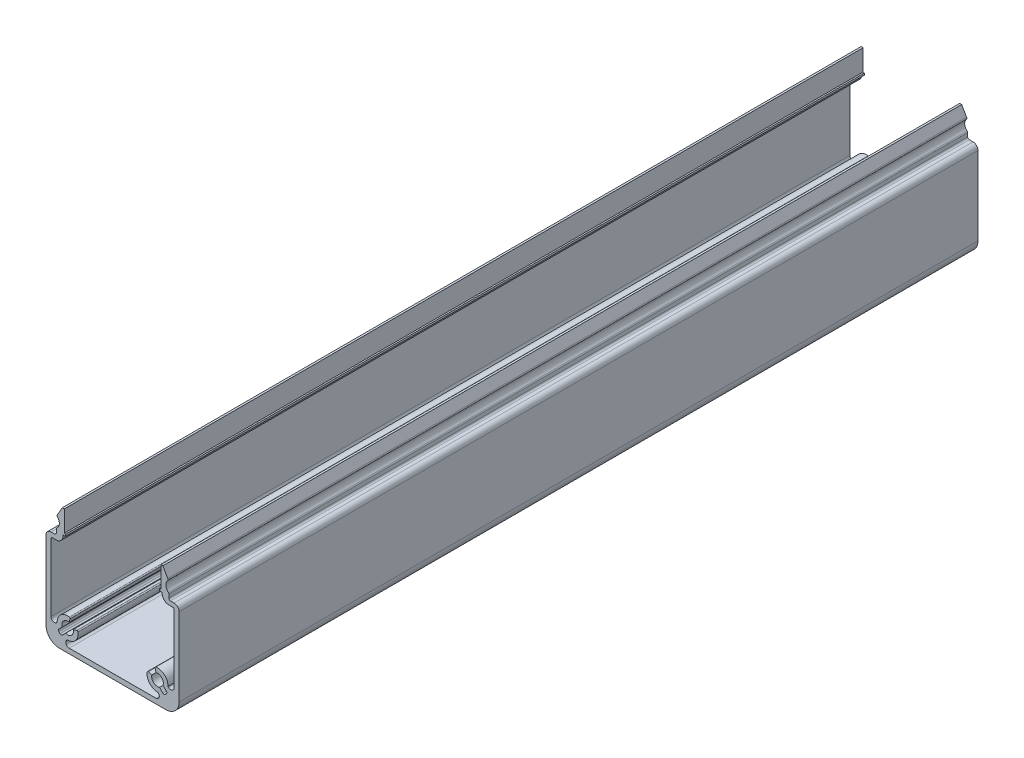
from build123d import *

# Parameters (mm, degrees)
BOSS_EXTRUDE1_DEPTH = 240


with BuildPart() as part:
    # Sketch1 → Boss-Extrude1 (new body)
    with BuildSketch(Plane.XY.offset(20)):
        with BuildLine():
            Line((4, 0), (36, 0))
            ThreePointArc((36, 0), (38.828427125, 1.171572875), (40, 4))
            Line((40, 4), (40, 27.499999994))
            ThreePointArc((40, 27.499999994), (39.56066017, 28.56066017), (38.499999994, 29))
            Line((38.499999994, 29), (37.408493132, 29))
            ThreePointArc((37.408493132, 29), (37.05493974, 29.14644661), (36.90849313, 29.500000002))
            Line((36.90849313, 29.500000002), (36.90849313, 30.572020267))
            ThreePointArc((36.90849313, 30.572020267), (36.86079319, 30.785150869), (36.726794508, 30.957616203))
            ThreePointArc((36.726794508, 30.957616203), (36.005111578, 32.357100716), (36.519951827, 33.845160752))
            ThreePointArc((36.519951827, 33.845160752), (36.647077826, 34.128030253), (36.582952488, 34.431450944))
            Line((36.582952488, 34.431450944), (35.099999998, 37.000000001))
            Line((35.099999998, 37.000000001), (34.500000002, 37.000000001))
            Line((34.500000002, 37.000000001), (34.500000002, 30.672689193))
            Line((34.500000002, 30.672689193), (34.158493132, 30.561067543))
            Line((34.158493132, 30.561067543), (34.158493132, 29.989862813))
            Line((34.158493132, 29.989862813), (34.908493132, 29.989862813))
            Line((34.908493132, 29.989862813), (34.908493132, 29.700000011))
            ThreePointArc((34.908493132, 29.700000011), (35.494279572, 28.285786443), (36.908493141, 27.700000003))
            Line((36.908493141, 27.700000003), (38.000000017, 27.700000003))
            ThreePointArc((38.000000017, 27.700000003), (38.353553409, 27.553553393), (38.500000019, 27.200000001))
            Line((38.500000019, 27.200000001), (38.500000019, 6.9547727))
            ThreePointArc((38.500000019, 6.9547727), (37.882683451, 6.030893167), (36.792893237, 6.247665919))
            Line((36.792893237, 6.247665919), (36.648161659, 6.392397496))
            ThreePointArc((36.648161659, 6.392397496), (35.587251229, 8.859212237), (33.009530056, 9.611581471))
            ThreePointArc((33.009530056, 9.611581471), (32.804700675, 9.478725012), (32.766463725, 9.237594653))
            Line((32.766463725, 9.237594653), (33.047066675, 8.190370192))
            ThreePointArc((33.047066675, 8.190370192), (34.786339421, 7.686520507), (35.148364083, 5.912296075))
            Line((35.148364083, 5.912296075), (36.146446608, 4.91421355))
            ThreePointArc((36.146446608, 4.91421355), (36.292893217, 4.560660161), (36.146446608, 4.207106773))
            Line((36.146446608, 4.207106773), (35.792893214, 3.853553379))
            ThreePointArc((35.792893214, 3.853553379), (35.439339826, 3.70710677), (35.085786437, 3.853553379))
            Line((35.085786437, 3.853553379), (34.087703906, 4.85163591))
            ThreePointArc((34.087703906, 4.85163591), (32.313479487, 5.213660585), (31.809629807, 6.952933321))
            Line((31.809629807, 6.952933321), (30.762405333, 7.233536272))
            ThreePointArc((30.762405333, 7.233536272), (30.521274984, 7.195299323), (30.38841853, 6.990469949))
            ThreePointArc((30.38841853, 6.990469949), (31.140787752, 4.412748784), (33.607602477, 3.351838341))
            Line((33.607602477, 3.351838341), (33.752334032, 3.207106785))
            ThreePointArc((33.752334032, 3.207106785), (33.969106782, 2.117316579), (33.045227255, 1.500000015))
            Line((33.045227255, 1.500000015), (6.954772716, 1.500000015))
            ThreePointArc((6.954772716, 1.500000015), (6.030893183, 2.117316583), (6.247665934, 3.207106797))
            Line((6.247665934, 3.207106797), (6.392397512, 3.351838375))
            ThreePointArc((6.392397512, 3.351838375), (8.859212224, 4.412748803), (9.611581449, 6.990469949))
            ThreePointArc((9.611581449, 6.990469949), (9.478724996, 7.195299323), (9.237594646, 7.233536272))
            Line((9.237594646, 7.233536272), (8.190370187, 6.952933328))
            ThreePointArc((8.190370187, 6.952933328), (7.686520502, 5.213660596), (5.912296085, 4.851635932))
            Line((5.912296085, 4.851635932), (4.914213553, 3.8535534))
            ThreePointArc((4.914213553, 3.8535534), (4.560660164, 3.707106791), (4.207106776, 3.8535534))
            Line((4.207106776, 3.8535534), (3.853553388, 4.207106787))
            ThreePointArc((3.853553388, 4.207106787), (3.70710678, 4.560660175), (3.853553388, 4.914213564))
            Line((3.853553388, 4.914213564), (4.85163592, 5.912296095))
            ThreePointArc((4.85163592, 5.912296095), (5.213660585, 7.686520517), (6.952933322, 8.190370198))
            Line((6.952933322, 8.190370198), (7.233536268, 9.237594644))
            ThreePointArc((7.233536268, 9.237594644), (7.195299318, 9.478725003), (6.990469936, 9.611581462))
            ThreePointArc((6.990469936, 9.611581462), (4.412748785, 8.859212233), (3.351838362, 6.392397513))
            Line((3.351838362, 6.392397513), (3.207106785, 6.247665935))
            ThreePointArc((3.207106785, 6.247665935), (2.11731657, 6.030893183), (1.500000002, 6.954772717))
            Line((1.500000002, 6.954772717), (1.500000002, 27.200000001))
            ThreePointArc((1.500000002, 27.200000001), (1.646446612, 27.553553393), (2.000000004, 27.700000003))
            Line((2.000000004, 27.700000003), (3.091506864, 27.700000003))
            ThreePointArc((3.091506864, 27.700000003), (4.505720432, 28.285786443), (5.091506872, 29.700000011))
            Line((5.091506872, 29.700000011), (5.091506872, 29.989862813))
            Line((5.091506872, 29.989862813), (5.841506868, 29.989862813))
            Line((5.841506868, 29.989862813), (5.841506868, 30.561067541))
            Line((5.841506868, 30.561067541), (5.499999998, 30.672689191))
            Line((5.499999998, 30.672689191), (5.499999998, 37.000000001))
            Line((5.499999998, 37.000000001), (4.899999998, 37.000000001))
            Line((4.899999998, 37.000000001), (3.417047508, 34.431450944))
            ThreePointArc((3.417047508, 34.431450944), (3.35292217, 34.128030253), (3.480048169, 33.845160751))
            ThreePointArc((3.480048169, 33.845160751), (3.99488842, 32.357100716), (3.273205491, 30.957616203))
            ThreePointArc((3.273205491, 30.957616203), (3.13920681, 30.785150869), (3.09150687, 30.572020267))
            Line((3.09150687, 30.572020267), (3.09150687, 29.500000002))
            ThreePointArc((3.09150687, 29.500000002), (2.94506026, 29.14644661), (2.591506868, 29))
            Line((2.591506868, 29), (1.500000006, 29))
            ThreePointArc((1.500000006, 29), (0.43933983, 28.56066017), (0, 27.499999994))
            Line((0, 27.499999994), (0, 4))
            ThreePointArc((0, 4), (1.171572875, 1.171572875), (4, 0))
        make_face()
    extrude(amount=-BOSS_EXTRUDE1_DEPTH)


solid = part.part
